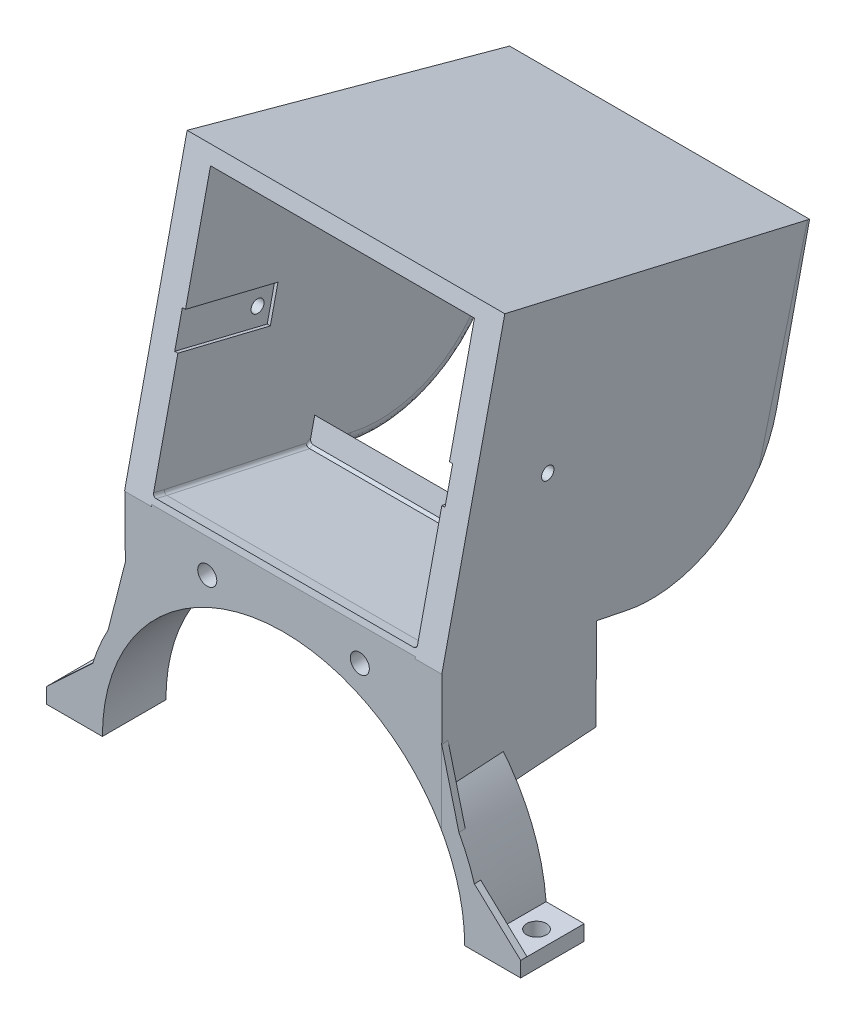
from build123d import *

# Parameters (mm, degrees)
BASE_R                 = 1.5
BOSS_EXTRUDE1_DEPTH    = 25
BOSS_EXTRUDE2_DEPTH    = 22
CUT_EXTRUDE1_DEPTH     = 22.5
BOSS_EXTRUDE3_START    = -33
BOSS_EXTRUDE3_DEPTH    = 55
CUT_EXTRUDE11_DEPTH    = 0.5
SKETCH23_R             = 1
CUT_EXTRUDE12_DEPTH    = 99.094279887
CUT_EXTRUDE15_DEPTH    = 76.944355981
CUT_EXTRUDE16_DEPTH    = 100.349434145
BOSS_EXTRUDE5_DEPTH    = 10
BOSS_EXTRUDE6_DEPTH    = 1
SKETCH34_R             = 1.55
CUT_EXTRUDE18_DEPTH    = 93.160571402
FILLET13_R             = 20
FILLET14_R             = 2
FILLET17_R             = 0.5
MIRROR42_COPY_1_DEPTH  = 0.5
FILLET13_OF_MIRROR42_R = 20
FILLET14_OF_MIRROR42_R = 2
FILLET17_OF_MIRROR42_R = 0.5


with BuildPart() as part:
    # base → Boss-Extrude1 (new body)
    with BuildSketch(Plane.XY):
        with BuildLine():
            Line((0, 35.5), (25, 35.5))
            Line((25, 35.5), (25, 13.683932183))
            ThreePointArc((25, 13.683932183), (14.530277574, 24.517769752), (0, 28.5))
            Line((0, 28.5), (0, 35.5))
        make_face()
        with Locations((12, 30.225)):
            Circle(BASE_R, mode=Mode.SUBTRACT)
    boss_extrude1 = extrude(amount=BOSS_EXTRUDE1_DEPTH)

    # Sketch1 → Boss-Extrude2 (add)
    with BuildSketch(Plane.ZY):
        Polygon((25, 35.5), (24.792423, 36.428467271), (23.135628798, 36.058058554), (20.264666421, 35.5), align=None)
        Polygon((15.177086702, 79.436724709), (-34.161619053, 66.947807182), (-33.626522555, 64.554384088), (14.065750651, 76.626546453), (15.722544854, 76.99695517), align=None)
    boss_extrude2 = extrude(amount=-BOSS_EXTRUDE2_DEPTH)


with BuildPart() as boss_extrude2_piece_1:
    # of the separate pieces the step leaves, piece 1, a body of its own (boss_extrude2_pieces)
    add(part.part.solids().sort_by_distance((0, 28.5, 0))[0])

    # Sketch2 → Cut-Extrude1 (cut)
    with BuildSketch(Plane.ZY):
        Polygon((0, 35.5), (0.765370017, 32.0765908), (1.287696682, 31.811250756), (20.264666421, 35.5), align=None)
    cut_extrude1 = extrude(amount=-CUT_EXTRUDE1_DEPTH, mode=Mode.SUBTRACT)

    # Sketch6 → Boss-Extrude3 (add)
    with BuildSketch(Plane(origin=(0, 49.699602786, -11.111317294), x_dir=(0, 0.21818326067427152, 0.9759078157088111), z_dir=(0, -0.9759078157088111, 0.21818326067427152)).offset(BOSS_EXTRUDE3_START)):
        Polygon((-18.731700165, -19.367108639), (30.615918322, -20.72), (32.143201147, -20.761871276), (32.143201147, -25), (-18.731700165, -23.605237363), align=None)
    boss_extrude3 = extrude(amount=BOSS_EXTRUDE3_DEPTH)

    # Sketch22 → Cut-Extrude11 (cut)
    with BuildSketch(Plane(origin=(19.865716918, -0.118828987, -0.531507949), x_dir=(0.02674450738619923, -0.00015997523468622664, 0.999642288887677), z_dir=(-0.9996244059329674, 0.00597936415982469, 0.02674498583671672))):
        Polygon((20.196212319, 59.519582361), (6.045802137, 56.354793001), (6.646020809, 53.671094519), (20.79643099, 56.835883879), (20.909777655, 56.861234262), (20.315228686, 59.519582361), align=None)
    cut_extrude11 = extrude(amount=-CUT_EXTRUDE11_DEPTH, mode=Mode.SUBTRACT)

    # Mirror2: Cut-Extrude11 across plane
    add(cut_extrude11.mirror(Plane(origin=(20.864307529, 53.547252509, 6.098763011), x_dir=(0, 0.2181832606742717, 0.975907815708811), z_dir=(0, -0.9759078157088111, 0.2181832606742717))), mode=Mode.SUBTRACT)

    # Sketch23 → Cut-Extrude12 (cut, through all)
    with BuildSketch(Plane(origin=(19.865716918, -0.118828987, -0.531507949), x_dir=(0.026744507386199233, -0.00015997523468622667, 0.999642288887677), z_dir=(-0.9996244059329675, 0.005979364159824691, 0.026744985836716723))):
        with Locations(Location((8.708767837, 54.132435198, 0), (0, 0, 0.00916607))):
            Circle(SKETCH23_R)
    cut_extrude12 = extrude(amount=-CUT_EXTRUDE12_DEPTH, mode=Mode.SUBTRACT)

    # Sketch28 → Cut-Extrude15 (cut, through all)
    with BuildSketch(Plane(origin=(0, 71.043074178, -17.982861138), x_dir=(1, 0, 0), z_dir=(0, 0.9694252279734551, -0.24538689322906931))):
        Polygon((25, -34.477438769), (28.699873794, -1.570635788), (23.605237363, 16.37756889), align=None)
    cut_extrude15 = extrude(amount=-CUT_EXTRUDE15_DEPTH, mode=Mode.SUBTRACT)

    # Sketch29 → Cut-Extrude16 (cut, through all)
    with BuildSketch(Plane.ZY):
        Polygon((-34.161619053, 66.947807182), (-36.591777489, 77.817617284), (13.057436325, 88.917669139), (15.177086702, 79.436724709), align=None)
    cut_extrude16 = extrude(amount=-CUT_EXTRUDE16_DEPTH, mode=Mode.SUBTRACT)

    # Fillet13
    fillet13_edges = [boss_extrude2_piece_1.edges().sort_by_distance(p)[0] for p in [
        (21.486173001, 24.14268742, -24.591698152),
    ]]
    fillet(fillet13_edges, radius=FILLET13_R)

    # Fillet14
    fillet14_edges = [boss_extrude2_piece_1.edges().sort_by_distance(p)[0] for p in [
        (19.367108639, 55.304325458, -31.558491209),
        (19.527741539, 31.136504682, -20.151464465),
        (19.986683172, 29.073497339, -2.536770919),
    ]]
    fillet(fillet14_edges, radius=FILLET14_R)

    # Fillet17
    fillet17_edges = [boss_extrude2_piece_1.edges().sort_by_distance(p)[0] for p in [
        (20.738599662, 36.243262913, 23.964025899),
        (20.41035558, 33.934654655, 12.21166274),
        (20.099189258, 31.943920778, 1.02653335),
    ]]
    fillet(fillet17_edges, radius=FILLET17_R)


with BuildPart() as boss_extrude2_piece_2:
    # of the separate pieces the step leaves, piece 2, a body of its own (boss_extrude2_pieces)
    add(part.part.solids().sort_by_distance((0, 79.436724709, 15.177086702))[0])


with BuildPart() as body_3:
    # Sketch33 → Boss-Extrude5 (new body)
    with BuildSketch(Plane.XY.offset(25)):
        with BuildLine():
            Line((28.5, 0), (31.5, 0))
            Line((31.5, 0), (37.308145905, 0))
            Line((37.308145905, 0), (37.308145905, 2.4))
            Line((37.308145905, 2.4), (31.308145905, 2.4))
            ThreePointArc((31.308145905, 2.4), (28.599185333, 12.96327884), (22.440740932, 21.962994933))
            Line((22.440740932, 21.962994933), (20.368188425, 19.934565465))
            ThreePointArc((20.368188425, 19.934565465), (26.388855319, 10.764679045), (28.5, 0))
        make_face()
    boss_extrude5 = extrude(amount=-BOSS_EXTRUDE5_DEPTH)

    # Sketch35 → Boss-Extrude6 (add)
    with BuildSketch(Plane.XY.offset(25)):
        Polygon((37.308145905, 2.4), (30.025781314, 2.4), (30.025781314, 9.187625182), align=None)
        Polygon((27.738483134, 14.415137804), (24.527449643, 27.000912751), (24.232182196, 17.921438743), align=None)
    boss_extrude6 = extrude(amount=-BOSS_EXTRUDE6_DEPTH)

    # Sketch34 → Cut-Extrude18 (cut, through all)
    with BuildSketch(Plane(origin=(0, 2.4, 0), x_dir=(1, 0, 0), z_dir=(0, 1, 0))):
        with Locations(Location((34.308145905, -19.5, 0), (0, 0, 180))):
            Circle(SKETCH34_R)
    cut_extrude18 = extrude(amount=-CUT_EXTRUDE18_DEPTH, mode=Mode.SUBTRACT)


with BuildPart() as boss_extrude2_piece_1_1:
    add(boss_extrude2_piece_1.part)

    add(boss_extrude2_piece_2.part)  # Mirror42 merges Boss-Extrude2 piece 2
    # Mirror42: Boss-Extrude1, Boss-Extrude2, Cut-Extrude1, Boss-Extrude3, Cut-Extrude11, Cut-Extrude12, Cut-Extrude15, Cut-Extrude16, Boss-Extrude5, Boss-Extrude6, Cut-Extrude18 across plane
    add(boss_extrude1.mirror(Plane(origin=(0, 35.5, 25), x_dir=(0, 0, 1), z_dir=(1, 0, 0))))
    add(boss_extrude2.mirror(Plane(origin=(0, 35.5, 25), x_dir=(0, 0, 1), z_dir=(1, 0, 0))))
    add(cut_extrude1.mirror(Plane(origin=(0, 35.5, 25), x_dir=(0, 0, 1), z_dir=(1, 0, 0))), mode=Mode.SUBTRACT)
    add(boss_extrude3.mirror(Plane(origin=(0, 35.5, 25), x_dir=(0, 0, 1), z_dir=(1, 0, 0))))
    add(cut_extrude11.mirror(Plane(origin=(0, 35.5, 25), x_dir=(0, 0, 1), z_dir=(1, 0, 0))), mode=Mode.SUBTRACT)
    add(cut_extrude12.mirror(Plane(origin=(0, 35.5, 25), x_dir=(0, 0, 1), z_dir=(1, 0, 0))), mode=Mode.SUBTRACT)
    add(cut_extrude15.mirror(Plane(origin=(0, 35.5, 25), x_dir=(0, 0, 1), z_dir=(1, 0, 0))), mode=Mode.SUBTRACT)
    add(cut_extrude16.mirror(Plane(origin=(0, 35.5, 25), x_dir=(0, 0, 1), z_dir=(1, 0, 0))), mode=Mode.SUBTRACT)
    add(boss_extrude5.mirror(Plane(origin=(0, 35.5, 25), x_dir=(0, 0, 1), z_dir=(1, 0, 0))))
    add(boss_extrude6.mirror(Plane(origin=(0, 35.5, 25), x_dir=(0, 0, 1), z_dir=(1, 0, 0))))
    add(cut_extrude18.mirror(Plane(origin=(0, 35.5, 25), x_dir=(0, 0, 1), z_dir=(1, 0, 0))), mode=Mode.SUBTRACT)

    # Mirror42 copy 1 sketch → Mirror42 copy 1 (cut)
    with BuildSketch(Plane(origin=(-19.865716918, 99.280376584, -22.754142537), x_dir=(-0.026744507386199226, 0.4258459105022663, 0.9044003493106167), z_dir=(0.9996244059329674, 0.00597936415982469, 0.026744985836716723))):
        Polygon((20.196212319, 59.519582361), (6.045802137, 56.354793001), (6.646020809, 53.671094519), (20.79643099, 56.835883879), (20.909777655, 56.861234262), (20.315228686, 59.519582361), align=None)
    extrude(amount=-MIRROR42_COPY_1_DEPTH, mode=Mode.SUBTRACT)

    # Fillet13 of Mirror42
    fillet13_of_mirror42_edges = [boss_extrude2_piece_1_1.edges().sort_by_distance(p)[0] for p in [
        (-21.486173001, 24.14268742, -24.591698152),
    ]]
    fillet(fillet13_of_mirror42_edges, radius=FILLET13_OF_MIRROR42_R)

    # Fillet14 of Mirror42
    fillet14_of_mirror42_edges = [boss_extrude2_piece_1_1.edges().sort_by_distance(p)[0] for p in [
        (-19.367108639, 55.304325458, -31.558491209),
        (-19.527741539, 31.136504682, -20.151464465),
        (-19.986683172, 29.073497339, -2.536770919),
    ]]
    fillet(fillet14_of_mirror42_edges, radius=FILLET14_OF_MIRROR42_R)

    # Fillet17 of Mirror42
    fillet17_of_mirror42_edges = [boss_extrude2_piece_1_1.edges().sort_by_distance(p)[0] for p in [
        (-20.738599662, 36.243262913, 23.964025899),
        (-20.41035558, 33.934654655, 12.21166274),
        (-20.099189258, 31.943920778, 1.02653335),
    ]]
    fillet(fillet17_of_mirror42_edges, radius=FILLET17_OF_MIRROR42_R)


solid = Compound([body_3.part, boss_extrude2_piece_1_1.part])
